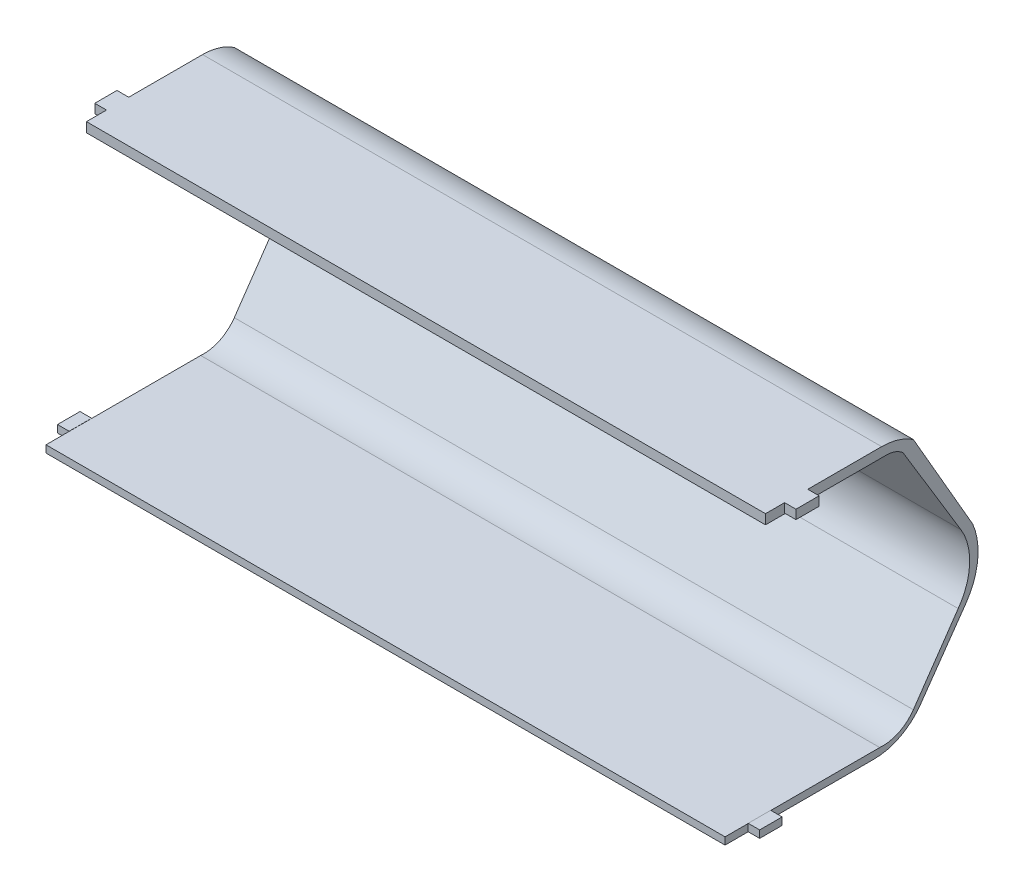
from build123d import *

# Parameters (mm, degrees)
BOSS_EXTRUDE1_DEPTH = 152.146
SKETCH2_W           = 2.629781943
SKETCH2_H           = 4.979405242
SKETCH2_W_2         = 2.539494313
SKETCH2_H_2         = 5.192930254
BOSS_EXTRUDE3_DEPTH = 2.032
SKETCH3_W           = 2.60862661
SKETCH3_H           = 5.045368892
SKETCH3_W_2         = 2.568412546
BOSS_EXTRUDE4_DEPTH = 1.651


with BuildPart() as part:
    # Sketch1 → Boss-Extrude1 (new body)
    with BuildSketch(Plane(origin=(0, 0, 0), x_dir=(0, 0, -1), z_dir=(1, 0, 0))):
        with BuildLine():
            Line((-32.603582083, 33.04768703), (-6.580220299, 33.04768703))
            ThreePointArc((-6.580220299, 33.04768703), (-2.866044415, 32.492434763), (0.523359095, 30.875229944))
            Line((0.523359095, 30.875229944), (13.81460794, 7.851288488))
            ThreePointArc((13.81460794, 7.851288488), (14.944302174, 0.295801394), (12.265554132, -6.858631022))
            Line((12.265554132, -6.858631022), (2.114134999, -21.333695036))
            ThreePointArc((2.114134999, -21.333695036), (-2.423671509, -25.308819533), (-8.283736886, -26.741626725))
            Line((-8.283736886, -26.741626725), (-41.665173314, -26.741626725))
            Line((-41.665173314, -26.741626725), (-41.665173314, -25.127558449))
            Line((-41.665173314, -25.127558449), (-7.009997937, -25.127558449))
            ThreePointArc((-7.009997937, -25.127558449), (-2.763170648, -24.353946154), (0.523359095, -21.555242836))
            Line((0.523359095, -21.555242836), (10.572249768, -6.954220772))
            ThreePointArc((10.572249768, -6.954220772), (13.138578862, 0.45392413), (11.185206305, 8.046749136))
            Line((11.185206305, 8.046749136), (-1.796106944, 29.486000218))
            ThreePointArc((-1.796106944, 29.486000218), (-3.505733028, 30.516318699), (-5.469291084, 30.875229944))
            Line((-5.469291084, 30.875229944), (-32.603582083, 30.875229944))
            Line((-32.603582083, 30.875229944), (-32.603582083, 33.04768703))
        make_face()
    extrude(amount=BOSS_EXTRUDE1_DEPTH)

    # Sketch2 → Boss-Extrude3 (add)
    with BuildSketch(Plane(origin=(0, 33.04768703, 0), x_dir=(1, 0, 0), z_dir=(0, 1, 0))):
        with Locations((-1.314890972, -25.618719559)):
            Rectangle(SKETCH2_W, SKETCH2_H)
        with Locations((153.415747157, -25.725482065)):
            Rectangle(SKETCH2_W_2, SKETCH2_H_2)
    extrude(amount=-BOSS_EXTRUDE3_DEPTH)

    # Sketch3 → Boss-Extrude4 (add)
    with BuildSketch(Plane.XZ.offset(26.741626725)):
        with Locations((-1.304313305, 33.959702232)):
            Rectangle(SKETCH3_W, SKETCH3_H)
        with Locations((153.430206273, 33.959702232)):
            Rectangle(SKETCH3_W_2, SKETCH3_H)
    extrude(amount=-BOSS_EXTRUDE4_DEPTH)


solid = part.part
